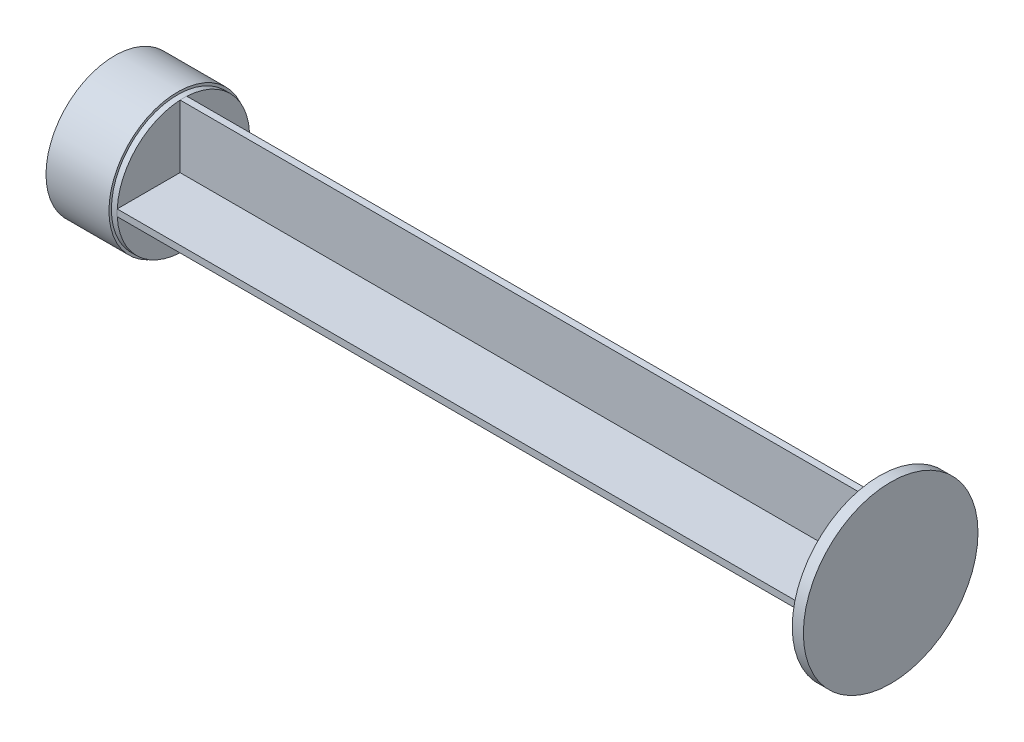
from build123d import *

# Parameters (mm, degrees)
BOSS_EXTRUDE1_DEPTH = 156.6625
SKETCH2_R           = 19.65
BOSS_EXTRUDE2_DEPTH = 2.5


with BuildPart() as part:
    # Sketch1 → Boss-Extrude1 (new body)
    with BuildSketch(Plane(origin=(0, 0, 0), x_dir=(0, 0, -1), z_dir=(1, 0, 0))):
        Polygon((1.5, 0), (0, 0), (0, -14.15), (-14.15, -14.15), (-14.15, -15.65), (0, -15.65), (0, -29.8), (1.5, -29.8), (1.5, -15.65), (15.65, -15.65), (15.65, -14.15), (1.5, -14.15), align=None)
    extrude(amount=BOSS_EXTRUDE1_DEPTH)

    # Sketch2 → Boss-Extrude2 (add)
    with BuildSketch(Plane(origin=(156.6625, 0, 0), x_dir=(0, 0, -1), z_dir=(1, 0, 0))):
        with Locations((0.75, -14.9)):
            Circle(SKETCH2_R)
    extrude(amount=BOSS_EXTRUDE2_DEPTH)

    # Sketch5 → Revolve2 (revolve)
    with BuildSketch(Plane(origin=(0, -14.9, 0), x_dir=(1, 0, 0), z_dir=(0, 1, 0))):
        Polygon((0, 15.65), (-1.3, 15.65), (-1.3, 16.2), (-15.465, 16.2), (-15.465, 0.75), (0, 0.75), align=None)
    revolve(axis=Axis((-15.465, -14.9, -0.75), (1, 0, 0)))


solid = part.part
